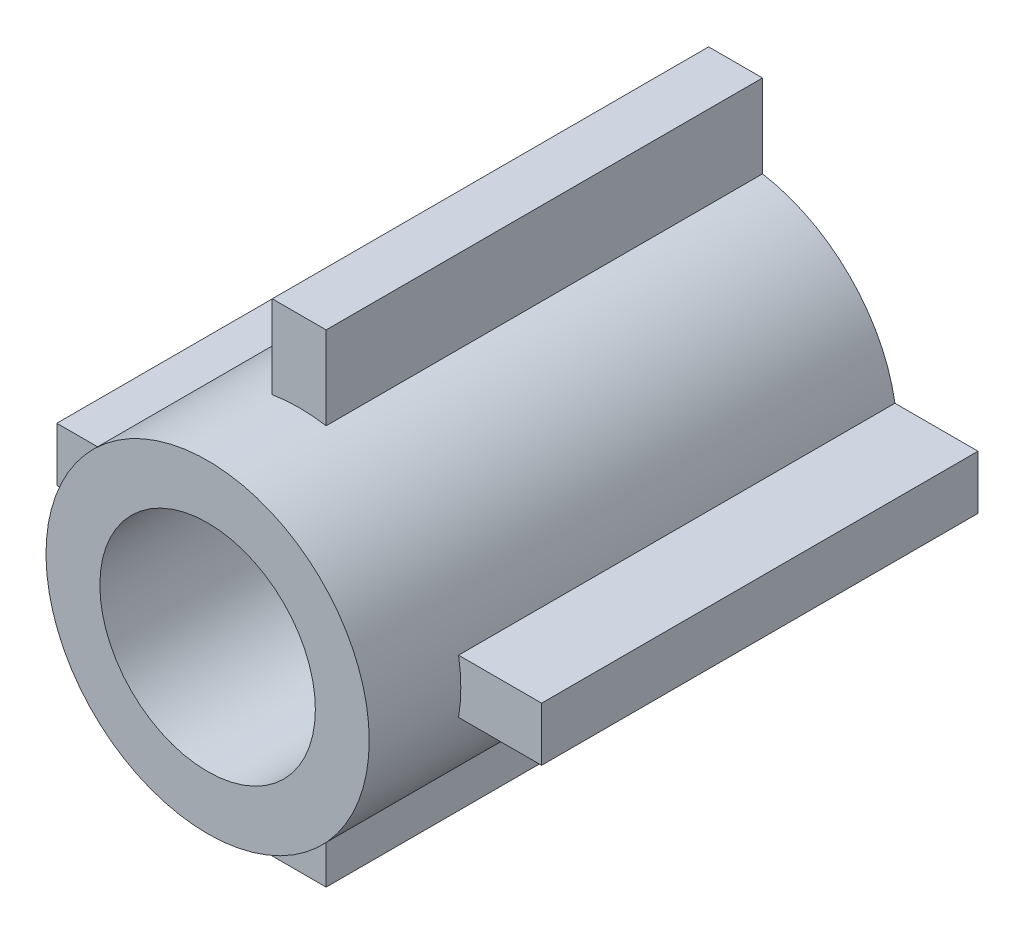
from build123d import *

# Parameters (mm, degrees)
ESBO_O1_R                = 3
ESBO_O1_R_2              = 2
RESSALTO_EXTRUS_O1_DEPTH = 8.1
RESSALTO_EXTRUS_O2_DEPTH = 8.1
RESSALTO_EXTRUS_O3_DEPTH = 8.1
RESSALTO_EXTRUS_O4_START = -8.1
ESBO_O6_R                = 2
RESSALTO_EXTRUS_O4_DEPTH = 8.1
ESBO_O7_R                = 3
ESBO_O7_R_2              = 2
RESSALTO_EXTRUS_O5_DEPTH = 1.7


with BuildPart() as part:
    # Esboço1 → Ressalto-extrusão1 (new body)
    with BuildSketch(Plane.XY):
        Circle(ESBO_O1_R)
        Circle(ESBO_O1_R_2, mode=Mode.SUBTRACT)
    extrude(amount=RESSALTO_EXTRUS_O1_DEPTH)

    # Esboço2 → Ressalto-extrusão2 (add)
    with BuildSketch(Plane.XY):
        with BuildLine():
            Line((-2.958039892, 0.5), (-2.998801098, 0.5))
            Line((-2.998801098, 0.5), (-4.498801098, 0.5))
            Line((-4.498801098, 0.5), (-4.498801098, -0.5))
            Line((-4.498801098, -0.5), (-3, -0.5))
            Line((-3, -0.5), (-2.958039892, -0.5))
            ThreePointArc((-2.958039892, -0.5), (-2.989491568, -0.250878781), (-3, 0))
            ThreePointArc((-3, 0), (-2.989491568, 0.250878781), (-2.958039892, 0.5))
        make_face()
    extrude(amount=RESSALTO_EXTRUS_O2_DEPTH)

    # Esboço3 → Ressalto-extrusão3 (add)
    with BuildSketch(Plane(origin=(0, 0, 0), x_dir=(-1, 0, 0), z_dir=(0, 0, -1))):
        with BuildLine():
            ThreePointArc((0.5, -2.958039892), (0.250878781, -2.989491568), (0, -3))
            ThreePointArc((0, -3), (-0.250878781, -2.989491568), (-0.5, -2.958039892))
            Line((-0.5, -2.958039892), (-0.5, -4.458039892))
            Line((-0.5, -4.458039892), (0.5, -4.458039892))
            Line((0.5, -4.458039892), (0.5, -3))
            Line((0.5, -3), (0.5, -2.958039892))
        make_face()
        with BuildLine():
            ThreePointArc((-2.958039892, -0.5), (-2.989491568, -0.250878781), (-3, 0))
            ThreePointArc((-3, 0), (-2.989491568, 0.250878781), (-2.958039892, 0.5))
            Line((-2.958039892, 0.5), (-3, 0.5))
            Line((-3, 0.5), (-4.5, 0.5))
            Line((-4.5, 0.5), (-4.5, -0.5))
            Line((-4.5, -0.5), (-2.958039892, -0.5))
        make_face()
        with BuildLine():
            Line((0.5, 4.5), (0.5, 3))
            Line((0.5, 3), (0.5, 2.958039892))
            ThreePointArc((0.5, 2.958039892), (0, 3), (-0.5, 2.958039892))
            Line((-0.5, 2.958039892), (-0.5, 3))
            Line((-0.5, 3), (-0.5, 4.5))
            Line((-0.5, 4.5), (0.5, 4.5))
        make_face()
    extrude(amount=-RESSALTO_EXTRUS_O3_DEPTH)

    # Esboço6 → Ressalto-extrusão4 (add)
    # profile 1 of 5: a face of its own
    with BuildSketch(Plane.XY.offset(8.1).offset(RESSALTO_EXTRUS_O4_START)):
        with BuildLine():
            ThreePointArc((2.958039892, 0.5), (2.121320344, 2.121320344), (0.5, 2.958039892))
            ThreePointArc((0.5, 2.958039892), (0.00124461, 2.999999742), (-0.497545425, 2.958453743))
            ThreePointArc((-0.497545425, 2.958453743), (-0.498772755, 2.958247072), (-0.5, 2.958039892))
            ThreePointArc((-0.5, 2.958039892), (-2.121320344, 2.121320344), (-2.958039892, 0.5))
            ThreePointArc((-2.958039892, 0.5), (-3, 0), (-2.958039892, -0.5))
            ThreePointArc((-2.958039892, -0.5), (-2.121320344, -2.121320344), (-0.5, -2.958039892))
            ThreePointArc((-0.5, -2.958039892), (0, -3), (0.5, -2.958039892))
            ThreePointArc((0.5, -2.958039892), (2.121320344, -2.121320344), (2.958039892, -0.5))
            ThreePointArc((2.958039892, -0.5), (2.989491568, -0.250878781), (3, 0))
            ThreePointArc((3, 0), (2.989491568, 0.250878781), (2.958039892, 0.5))
        make_face()
        Circle(ESBO_O6_R, mode=Mode.SUBTRACT)
    # profile 2 of 5: a face of its own
    with BuildSketch(Plane.XY.offset(8.1).offset(RESSALTO_EXTRUS_O4_START)):
        with BuildLine():
            ThreePointArc((-0.497545425, 2.958453743), (0.00124461, 2.999999742), (0.5, 2.958039892))
            Line((0.5, 2.958039892), (0.5, 4.5))
            Line((0.5, 4.5), (-0.497545425, 4.5))
            Line((-0.497545425, 4.5), (-0.497545425, 2.958453743))
        make_face()
    # profile 3 of 5: a face of its own
    with BuildSketch(Plane.XY.offset(8.1).offset(RESSALTO_EXTRUS_O4_START)):
        with BuildLine():
            Line((4.5, 0.5), (2.958039892, 0.5))
            ThreePointArc((2.958039892, 0.5), (2.989491568, 0.250878781), (3, 0))
            ThreePointArc((3, 0), (2.989491568, -0.250878781), (2.958039892, -0.5))
            Line((2.958039892, -0.5), (4.5, -0.5))
            Line((4.5, -0.5), (4.5, 0.5))
        make_face()
    # profile 4 of 5: a face of its own
    with BuildSketch(Plane.XY.offset(8.1).offset(RESSALTO_EXTRUS_O4_START)):
        with BuildLine():
            Line((0.5, -4.458039892), (0.5, -2.958039892))
            ThreePointArc((0.5, -2.958039892), (0, -3), (-0.5, -2.958039892))
            Line((-0.5, -2.958039892), (-0.5, -4.458039892))
            Line((-0.5, -4.458039892), (0.5, -4.458039892))
        make_face()
    # profile 5 of 5: a face of its own
    with BuildSketch(Plane.XY.offset(8.1).offset(RESSALTO_EXTRUS_O4_START)):
        with BuildLine():
            ThreePointArc((-2.958039892, -0.5), (-3, 0), (-2.958039892, 0.5))
            Line((-2.958039892, 0.5), (-4.498801098, 0.5))
            Line((-4.498801098, 0.5), (-4.498801098, -0.5))
            Line((-4.498801098, -0.5), (-2.958039892, -0.5))
        make_face()
    extrude(amount=RESSALTO_EXTRUS_O4_DEPTH)

    # Esboço7 → Ressalto-extrusão5 (add)
    with BuildSketch(Plane.XY.offset(8.1)):
        with Locations(Location((0, 0, 0), (0, 0, 170.405931773))):
            Circle(ESBO_O7_R)
        Circle(ESBO_O7_R_2, mode=Mode.SUBTRACT)
    extrude(amount=RESSALTO_EXTRUS_O5_DEPTH)


solid = part.part
